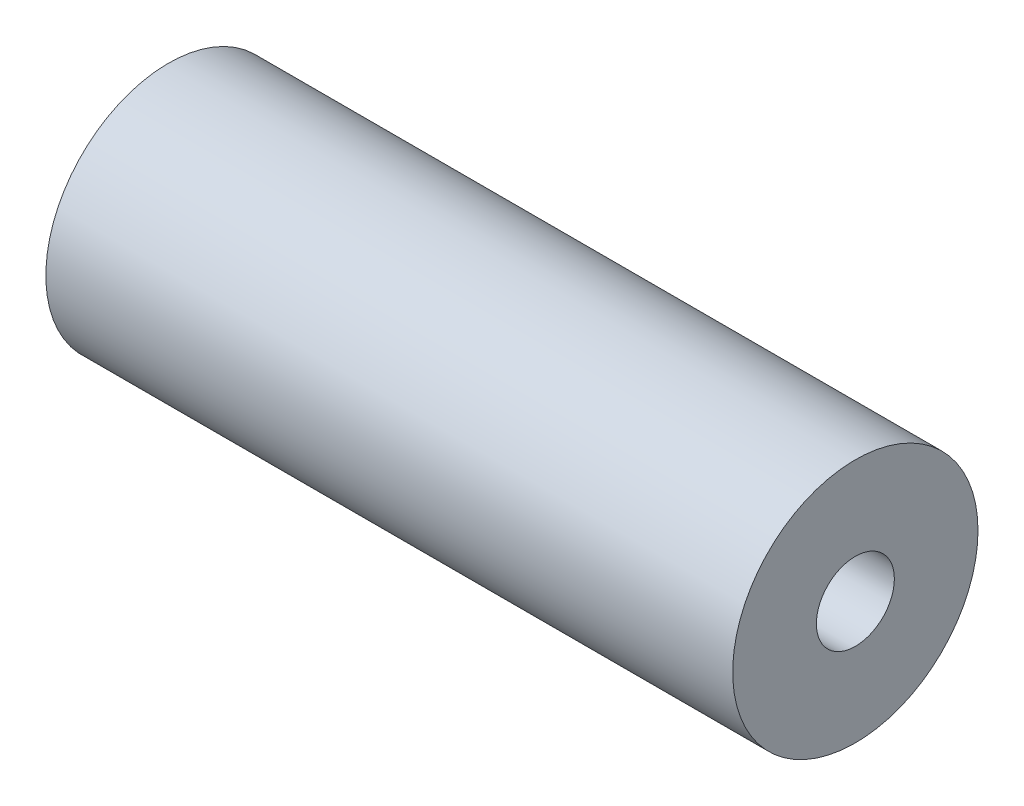
from build123d import *

# Parameters (mm, degrees)
SKETCH1_R           = 6.35
BOSS_EXTRUDE1_DEPTH = 17.78


with BuildPart() as part:
    # Sketch1 → Boss-Extrude1 (new, symmetric)
    with BuildSketch(Plane(origin=(0, 0, 0), x_dir=(0, 0, -1), z_dir=(1, 0, 0))):
        Circle(SKETCH1_R)
    extrude(amount=BOSS_EXTRUDE1_DEPTH, both=True)

    # Sketch4 → Tap Drill for #10-32 Tap1 (revolve, cut)
    with BuildSketch(Plane(origin=(17.78, 0, 0), x_dir=(0, 0, -1), z_dir=(0, 1, 0))):
        Polygon((0, 0), (0, 11.373317848), (2.0193, 10.16), (2.0193, 0), align=None)
    tap_drill_for_10_32_tap1 = revolve(axis=Axis((24.13, 0, 0), (-1, 0, 0)), mode=Mode.SUBTRACT)

    # Mirror1: Tap Drill for #10-32 Tap1 across plane
    add(tap_drill_for_10_32_tap1.mirror(Plane(origin=(0, 0, 0), x_dir=(0, 0, 1), z_dir=(1, 0, 0))), mode=Mode.SUBTRACT)


solid = part.part
